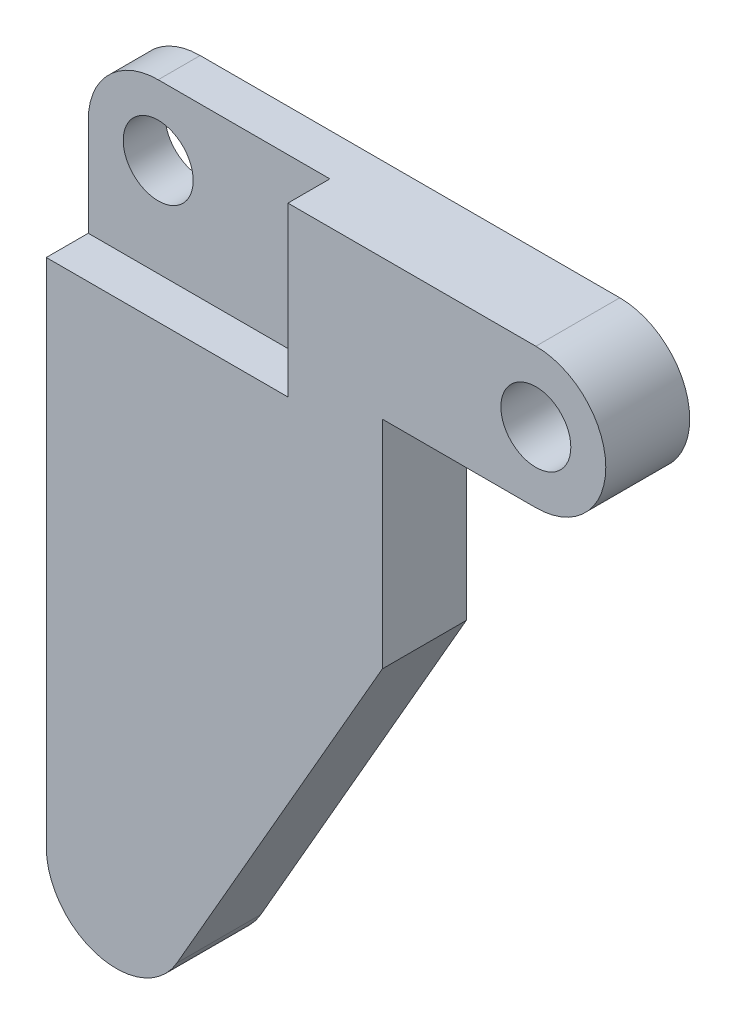
from build123d import *

# Parameters (mm, degrees)
SKETCH1_R           = 2.5
BOSS_EXTRUDE1_DEPTH = 6
CUT_EXTRUDE2_DEPTH  = 3


with BuildPart() as part:
    # Sketch1 → Boss-Extrude1 (new body)
    with BuildSketch(Plane.XY):
        with BuildLine():
            Line((30, 5), (0, 5))
            ThreePointArc((0, 5), (-3.535533906, 3.535533906), (-5, 0))
            Line((-5, 0), (-5, -43.530327794))
            ThreePointArc((-5, -43.530327794), (-1.289471128, -48.361193576), (4.334905684, -46.022032574))
            Line((4.334905684, -46.022032574), (19.026166695, -20.463133553))
            Line((19.026166695, -20.463133553), (19.026166695, -5))
            Line((19.026166695, -5), (30, -5))
            ThreePointArc((30, -5), (35, 0), (30, 5))
        make_face()
        Circle(SKETCH1_R, mode=Mode.SUBTRACT)
        with Locations((30, 0)):
            Circle(SKETCH1_R, mode=Mode.SUBTRACT)
    extrude(amount=-BOSS_EXTRUDE1_DEPTH)

    # Sketch3 → Cut-Extrude2 (cut)
    with BuildSketch(Plane.XY):
        with BuildLine():
            Line((12.275244192, 5), (12.275244192, -7.004190344))
            Line((12.275244192, -7.004190344), (-5, -7.004190344))
            Line((-5, -7.004190344), (-5, 0))
            ThreePointArc((-5, 0), (-3.535533906, 3.535533906), (0, 5))
            Line((0, 5), (12.275244192, 5))
        make_face()
    extrude(amount=-CUT_EXTRUDE2_DEPTH, mode=Mode.SUBTRACT)


solid = part.part
